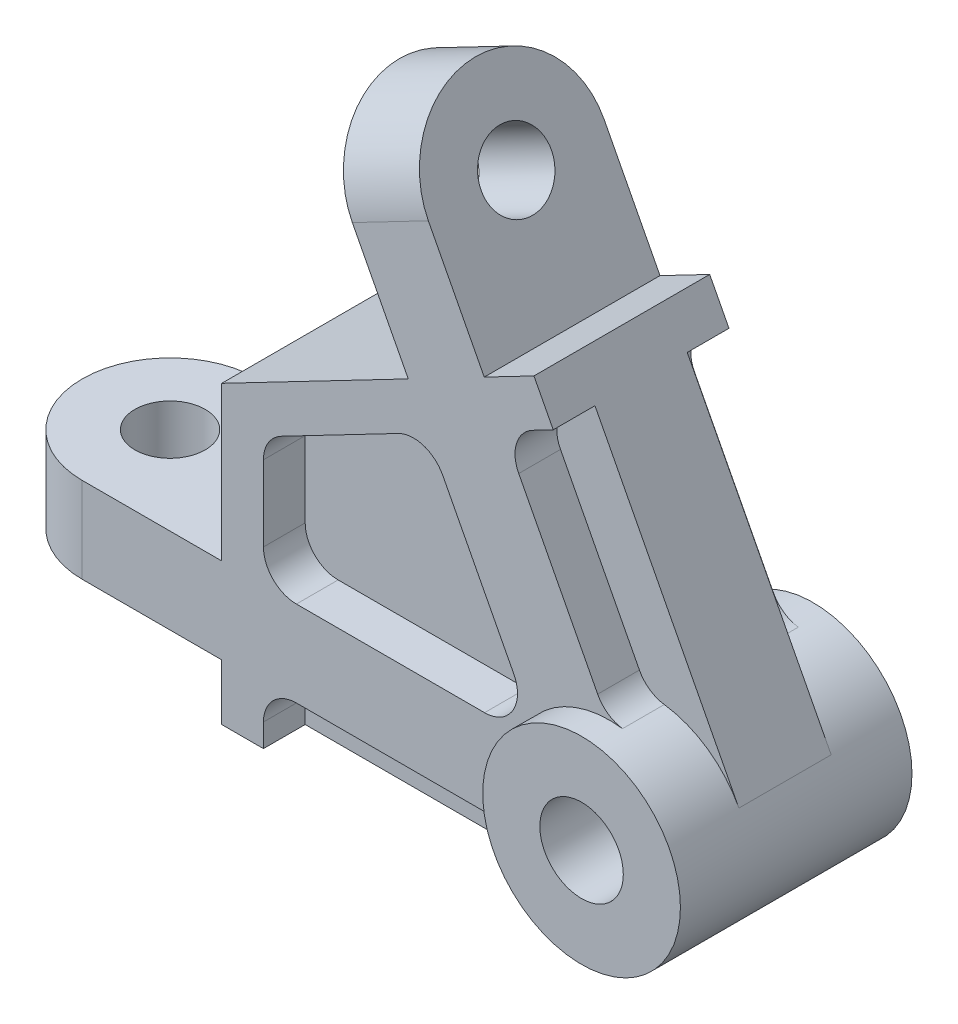
from build123d import *
from build123d.topology import SkipClean

# Parameters (mm, degrees)
SKETCH2_R            = 8
BOSS_EXTRUDE1_DEPTH  = 9.75
SKETCH3_R            = 8
BOSS_EXTRUDE2_DEPTH  = 9.75
SKETCH5_R            = 22.5
BOSS_EXTRUDE3_DEPTH  = 20
SKETCH6_R            = 9.5
CUT_EXTRUDE1_DEPTH   = 20
CUT_EXTRUDE3_DEPTH   = 9.5
FILLET1_R            = 7.5
FILLET1_OF_MIRROR1_R = 7.5
BOSS_EXTRUDE5_START  = 6.35
SKETCH9_R            = 22.5
SKETCH9_R_2          = 9.5
BOSS_EXTRUDE5_DEPTH  = 6.35


with BuildPart() as part:
    # Sketch2 → Boss-Extrude1 (new, symmetric)
    with BuildSketch(Plane(origin=(0, 0, 0), x_dir=(1, 0, 0), z_dir=(0, 1, 0))):
        with BuildLine():
            Line((0, -20), (-120, -20))
            ThreePointArc((-120, -20), (-140, 0), (-120, 20))
            Line((-120, 20), (0, 20))
            Line((0, 20), (0, -20))
        make_face()
        with Locations(Location((-120, 0, 0), (0, 0, 270))):
            Circle(SKETCH2_R, mode=Mode.SUBTRACT)
    extrude(amount=BOSS_EXTRUDE1_DEPTH, both=True)

    # Sketch3 → Boss-Extrude2 (add, symmetric)
    with BuildSketch(Plane(origin=(0, 0, 0), x_dir=(0.46174861323503175, -0.8870108331782229, 0), z_dir=(0.8870108331782228, 0.4617486132350317, 0))):
        with BuildLine():
            Line((0, -20), (-108, -20))
            ThreePointArc((-108, -20), (-128, 0), (-108, 20))
            Line((-108, 20), (0, 20))
            Line((0, 20), (0, -20))
        make_face()
        with Locations(Location((-108, 0, 0), (0, 0, 180))):
            Circle(SKETCH3_R, mode=Mode.SUBTRACT)
    extrude(amount=BOSS_EXTRUDE2_DEPTH, both=True)

    # Sketch5 → Boss-Extrude3 (add, symmetric)
    with BuildSketch(Plane.XY):
        with BuildLine():
            Line((-88.25, -22.5), (0, -22.5))
            ThreePointArc((0, -22.5), (-19.23551709, 11.672398309), (19.957743747, 10.389343798))
            Line((19.957743747, 10.389343798), (-17.18672299, 81.743200515))
            Line((-17.18672299, 81.743200515), (-88.25, 44.75))
            Line((-88.25, 44.75), (-88.25, -22.5))
        make_face()
        Circle(SKETCH5_R)
    extrude(amount=BOSS_EXTRUDE3_DEPTH, both=True)

    # Sketch6 → Cut-Extrude1 (cut, symmetric)
    with BuildSketch(Plane.XY):
        Circle(SKETCH6_R)
    extrude(amount=CUT_EXTRUDE1_DEPTH, both=True, mode=Mode.SUBTRACT)

    # Sketch7 → Cut-Extrude3 (cut)
    with BuildSketch(Plane.XY.offset(20)):
        with BuildLine():
            Line((-78.75, -22.5), (0, -22.5))
            ThreePointArc((0, -22.5), (-11.976539567, -19.047637649), (-20.277758752, -9.75))
            Line((-20.277758752, -9.75), (-78.75, -9.75))
            Line((-78.75, -9.75), (-78.75, -22.5))
        make_face()
        with BuildLine():
            Line((-12.800111165, 73.3165976), (-24.109499288, 67.429302781))
            Line((-24.109499288, 67.429302781), (-0.71487136, 22.488640665))
            ThreePointArc((-0.71487136, 22.488640665), (11.365310405, 19.41854061), (19.957743747, 10.389343798))
            Line((19.957743747, 10.389343798), (-12.800111165, 73.3165976))
        make_face()
        Polygon((-16.067502725, 9.75), (-41.406210535, 58.425204823), (-78.75, 38.985258485), (-78.75, 9.75), align=None)
    cut_extrude3 = extrude(amount=-CUT_EXTRUDE3_DEPTH, mode=Mode.SUBTRACT)

    # Fillet1
    fillet1_edges = [part.edges().sort_by_distance(p)[0] for p in [
        (-20.277758752, -9.75, 15.25),
        (-78.75, -9.75, 15.25),
        (-78.75, 38.985258485, 15.25),
        (-41.406210535, 58.425204823, 15.25),
        (-16.067502725, 9.75, 15.25),
        (-78.75, 9.75, 15.25),
        (-0.71487136, 22.488640665, 15.25),
        (-24.109499288, 67.429302781, 15.25),
    ]]
    fillet(fillet1_edges, radius=FILLET1_R)

    # Mirror1: Cut-Extrude3 across plane
    add(cut_extrude3.mirror(Plane.XY), mode=Mode.SUBTRACT)

    # Fillet1 of Mirror1
    fillet1_of_mirror1_edges = [part.edges().sort_by_distance(p)[0] for p in [
        (-20.277758752, -9.75, -15.25),
        (-78.75, -9.75, -15.25),
        (-78.75, 38.985258485, -15.25),
        (-41.406210535, 58.425204823, -15.25),
        (-16.067502725, 9.75, -15.25),
        (-78.75, 9.75, -15.25),
        (-0.71487136, 22.488640665, -15.25),
        (-24.109499288, 67.429302781, -15.25),
    ]]
    fillet(fillet1_of_mirror1_edges, radius=FILLET1_OF_MIRROR1_R)

    # Sketch9 → Boss-Extrude5 (add)
    with SkipClean():  # the faces are left unmerged after this step: merging them gives an invalid solid
        with BuildSketch(Plane.XY.offset(20).offset(BOSS_EXTRUDE5_START)):
            with Locations(Location((0, 0, 0), (0, 0, 215.099632195))):
                Circle(SKETCH9_R)
            Circle(SKETCH9_R_2, mode=Mode.SUBTRACT)
        boss_extrude5 = extrude(amount=-BOSS_EXTRUDE5_DEPTH)

    # Mirror2: Boss-Extrude5 across plane
    with SkipClean():  # the faces are left unmerged after this step: merging them gives an invalid solid
        add(boss_extrude5.mirror(Plane.XY))


solid = part.part
